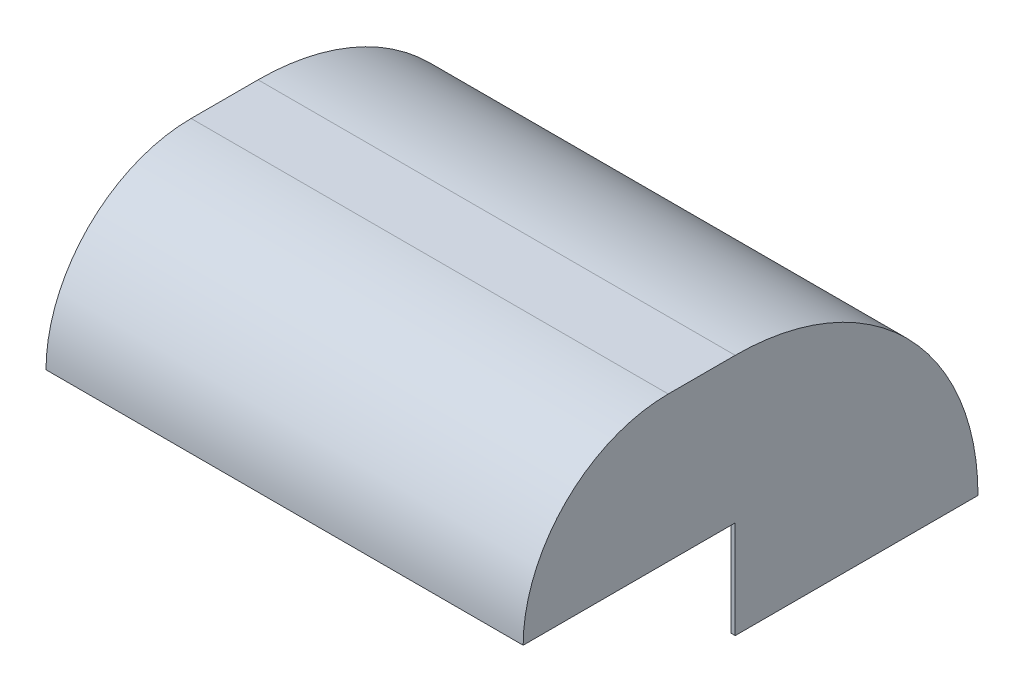
from build123d import *

# Parameters (mm, degrees)
SKETCH1_W                = 33.3375
SKETCH1_H                = 50.8
SKETCH1_W_2              = 26.9875
SKETCH1_H_2              = 44.45
BOSS_EXTRUDE1_DEPTH      = 25.4
FILLET2_R                = 2.54
SKETCH2_W                = 33.3375
SKETCH2_H                = 50.8
BOSS_EXTRUDE2_DEPTH      = 1.5875
SKETCH1_5_W              = 33.3375
SKETCH1_5_H              = 50.8
BOSS_EXTRUDE3_DEPTH      = 26.9875
SKETCH1_6_W              = 26.9875
SKETCH1_6_H              = 44.45
CUT_EXTRUDE1_DEPTH       = 25.4
FILLET4_R                = 2.54
BOSS_EXTRUDE4_DEPTH      = 31.75
BOSS_EXTRUDE4_DEPTH_BACK = 330.2
SKETCH6_W                = 231.775
SKETCH6_H                = 3.175
BOSS_EXTRUDE5_DEPTH      = 50.8
BOSS_EXTRUDE6_DEPTH      = 31.75
BOSS_EXTRUDE6_DEPTH_BACK = 330.2
BOSS_EXTRUDE7_START      = -3.175
BOSS_EXTRUDE7_DEPTH      = 3.175
SKETCH10_W               = 50.8
SKETCH10_H               = 3.2258
BOSS_EXTRUDE8_DEPTH      = 31.75
SKETCH11_W               = 3.175
SKETCH11_H               = 180.9242
BOSS_EXTRUDE9_DEPTH      = 50.8
BOSS_EXTRUDE12_START     = -3.175
BOSS_EXTRUDE12_DEPTH     = 3.175
SKETCH14_W               = 50.8
SKETCH14_H               = 3.2258
BOSS_EXTRUDE13_DEPTH     = 31.75
BOSS_EXTRUDE14_DEPTH     = 3.175
SKETCH17_W               = 3.175
SKETCH17_H               = 50.8
BOSS_EXTRUDE15_DEPTH     = 106.8324
BOSS_EXTRUDE16_DEPTH     = 3.175
CUT_EXTRUDE2_REACH       = 452.066
SKETCH21_W               = 50.8
SKETCH21_H               = 74.0918


with BuildPart() as part:
    # Sketch1 → Boss-Extrude1 (new body)
    with BuildSketch(Plane(origin=(0, 0, 0), x_dir=(1, 0, 0), z_dir=(0, 1, 0))):
        with Locations((0.204179282, 6.901311315)):
            Rectangle(SKETCH1_W, SKETCH1_H)
        with Locations((0.204179282, 6.901311315)):
            Rectangle(SKETCH1_W_2, SKETCH1_H_2, mode=Mode.SUBTRACT)
    extrude(amount=BOSS_EXTRUDE1_DEPTH)

    # Fillet2
    fillet2_edges = [part.edges().sort_by_distance(p)[0] for p in [
        (13.697929282, 12.7, 15.323688685),
        (13.697929282, 12.7, -29.126311315),
        (-13.289570718, 12.7, -29.126311315),
        (-13.289570718, 12.7, 15.323688685),
    ]]
    fillet(fillet2_edges, radius=FILLET2_R)

    # Sketch2 → Boss-Extrude2 (add)
    with BuildSketch(Plane(origin=(0, 25.4, 0), x_dir=(1, 0, 0), z_dir=(0, 1, 0))):
        with Locations((0.204179282, 6.901311315)):
            Rectangle(SKETCH2_W, SKETCH2_H)
    extrude(amount=BOSS_EXTRUDE2_DEPTH)



with BuildPart() as body_2:
    # Sketch1<5> → Boss-Extrude3 (new body)
    with BuildSketch(Plane(origin=(0, 0, 0), x_dir=(1, 0, 0), z_dir=(0, 1, 0))):
        with Locations((-264.908320718, 6.901311315)):
            Rectangle(SKETCH1_5_W, SKETCH1_5_H)
    extrude(amount=BOSS_EXTRUDE3_DEPTH)

    # Sketch1<6> → Cut-Extrude1 (cut)
    with BuildSketch(Plane(origin=(0, 0, 0), x_dir=(1, 0, 0), z_dir=(0, 1, 0))):
        with Locations((-264.908320718, 6.901311315)):
            Rectangle(SKETCH1_6_W, SKETCH1_6_H)
    extrude(amount=CUT_EXTRUDE1_DEPTH, mode=Mode.SUBTRACT)

    # Fillet4
    fillet4_edges = [body_2.edges().sort_by_distance(p)[0] for p in [
        (-251.414570718, 12.7, 15.323688685),
        (-251.414570718, 12.7, -29.126311315),
        (-278.402070718, 12.7, -29.126311315),
        (-278.402070718, 12.7, 15.323688685),
    ]]
    fillet(fillet4_edges, radius=FILLET4_R)


with BuildPart() as part_1:
    add(part.part)

    add(body_2.part)  # Boss-Extrude4 merges body 2
    # Sketch4 → Boss-Extrude4 (add, two sides: drawn at the far end of the back side and taken through both)
    with BuildSketch(Plane(origin=(16.872929282, 0, 0), x_dir=(0, 0, -1), z_dir=(1, 0, 0)).offset(-BOSS_EXTRUDE4_DEPTH_BACK)):
        with BuildLine():
            ThreePointArc((32.301311315, 23.8125), (160.269961041, -29.193850275), (213.276311315, -157.1625))
            Line((213.276311315, -157.1625), (216.451311315, -157.1625))
            ThreePointArc((216.451311315, -157.1625), (162.515025071, -26.948786244), (32.301311315, 26.9875))
            Line((32.301311315, 26.9875), (32.301311315, 23.8125))
        make_face()
    extrude(amount=BOSS_EXTRUDE4_DEPTH + BOSS_EXTRUDE4_DEPTH_BACK)

    # Sketch6 → Boss-Extrude5 (add, through all)
    with BuildSketch(Plane.XY.offset(-32.301311315)):
        with Locations((-132.352070718, 25.4)):
            Rectangle(SKETCH6_W, SKETCH6_H)
    extrude(amount=BOSS_EXTRUDE5_DEPTH)

    # Sketch7 → Boss-Extrude6 (add, two sides: drawn at the far end of the back side and taken through both)
    with BuildSketch(Plane(origin=(16.872929282, 0, 0), x_dir=(0, 0, -1), z_dir=(1, 0, 0)).offset(-BOSS_EXTRUDE6_DEPTH_BACK)):
        with BuildLine():
            Line((-18.498688685, 23.7617), (-18.498688685, 26.9875))
            ThreePointArc((-18.498688685, 26.9875), (-96.32158823, -5.247800455), (-128.556888685, -83.0707))
            Line((-128.556888685, -83.0707), (-125.331088685, -83.0707))
            ThreePointArc((-125.331088685, -83.0707), (-94.040603175, -7.52878551), (-18.498688685, 23.7617))
        make_face()
    extrude(amount=BOSS_EXTRUDE6_DEPTH + BOSS_EXTRUDE6_DEPTH_BACK)

    # Sketch9 → Boss-Extrude7 (add)
    with BuildSketch(Plane(origin=(48.622929282, 0, 0), x_dir=(0, 0, -1), z_dir=(1, 0, 0)).offset(BOSS_EXTRUDE7_START)):
        with BuildLine():
            Line((32.301311315, 23.8125), (32.301311315, -157.1625))
            Line((32.301311315, -157.1625), (213.276311315, -157.1625))
            ThreePointArc((213.276311315, -157.1625), (160.269961041, -29.193850275), (32.301311315, 23.8125))
        make_face()
    extrude(amount=BOSS_EXTRUDE7_DEPTH)

    # Sketch10 → Boss-Extrude8 (add)
    with BuildSketch(Plane(origin=(16.872929282, 0, 0), x_dir=(0, 0, -1), z_dir=(1, 0, 0))):
        with Locations((6.901311315, 25.3746)):
            Rectangle(SKETCH10_W, SKETCH10_H)
    extrude(amount=BOSS_EXTRUDE8_DEPTH)

    # Sketch11 → Boss-Extrude9 (add)
    with BuildSketch(Plane.XY.offset(-32.301311315)):
        with Locations((47.035429282, -66.7004)):
            Rectangle(SKETCH11_W, SKETCH11_H)
    extrude(amount=BOSS_EXTRUDE9_DEPTH)

    # Sketch13 → Boss-Extrude12 (add)
    with BuildSketch(Plane(origin=(48.622929282, 0, 0), x_dir=(0, 0, -1), z_dir=(1, 0, 0)).offset(BOSS_EXTRUDE12_START)):
        with BuildLine():
            Line((-125.331088685, -83.0707), (-18.498688685, -83.0707))
            Line((-18.498688685, -83.0707), (-18.498688685, 23.7617))
            ThreePointArc((-18.498688685, 23.7617), (-94.040603175, -7.52878551), (-125.331088685, -83.0707))
        make_face()
    extrude(amount=BOSS_EXTRUDE12_DEPTH)

    # Sketch14 → Boss-Extrude13 (add)
    with BuildSketch(Plane.ZY.offset(281.577070718)):
        with Locations((-6.901311315, 25.3746)):
            Rectangle(SKETCH14_W, SKETCH14_H)
    extrude(amount=BOSS_EXTRUDE13_DEPTH)

    # Sketch15 → Boss-Extrude14 (add)
    with BuildSketch(Plane.ZY.offset(313.327070718)):
        with BuildLine():
            Line((-213.276311315, -157.1625), (-32.301311315, -157.1625))
            Line((-32.301311315, -157.1625), (-32.301311315, 23.8125))
            ThreePointArc((-32.301311315, 23.8125), (-160.269961041, -29.193850275), (-213.276311315, -157.1625))
        make_face()
    extrude(amount=-BOSS_EXTRUDE14_DEPTH)

    # Sketch17 → Boss-Extrude15 (add)
    with BuildSketch(Plane.XZ.offset(-23.7617)):
        with Locations((-311.739570718, -6.901311315)):
            Rectangle(SKETCH17_W, SKETCH17_H)
    extrude(amount=BOSS_EXTRUDE15_DEPTH)

    # Sketch18 → Boss-Extrude16 (add)
    with BuildSketch(Plane.ZY.offset(313.327070718)):
        with BuildLine():
            Line((18.498688685, 23.7617), (18.498688685, -83.0707))
            Line((18.498688685, -83.0707), (125.331088685, -83.0707))
            ThreePointArc((125.331088685, -83.0707), (94.040603175, -7.52878551), (18.498688685, 23.7617))
        make_face()
    extrude(amount=-BOSS_EXTRUDE16_DEPTH)

    # Sketch21 → Cut-Extrude2 (cut, up to next)
    with BuildSketch(Plane(origin=(48.622929282, 0, 0), x_dir=(0, 0, -1), z_dir=(1, 0, 0)), mode=Mode.PRIVATE) as cut_extrude2_sk1:
        with Locations((6.901311315, -120.1166)):
            Rectangle(SKETCH21_W, SKETCH21_H)
    cut_extrude2_tool1 = extrude(cut_extrude2_sk1.sketch, amount=-CUT_EXTRUDE2_REACH, mode=Mode.PRIVATE) & part_1.part
    add(cut_extrude2_tool1.solids().sort_by_distance((48.622929, -120.1166, -6.901311))[0], mode=Mode.SUBTRACT)


solid = part_1.part
